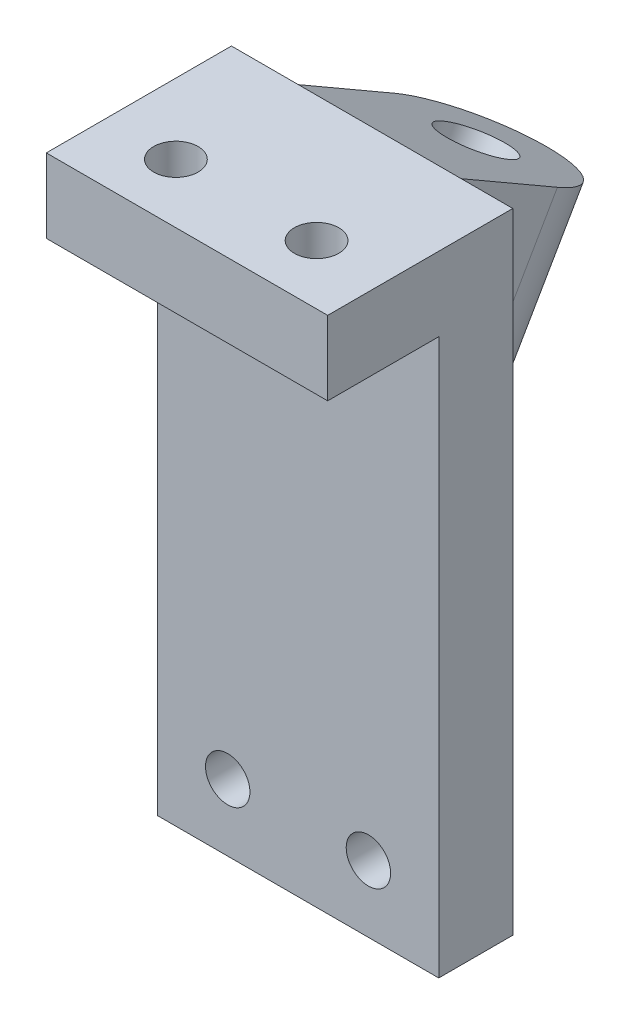
from build123d import *

# Parameters (mm, degrees)
SKETCH1_W           = 76
SKETCH1_H           = 50
SKETCH1_R           = 6
BOSS_EXTRUDE1_DEPTH = 20
SKETCH2_W           = 76
SKETCH2_H           = 20
BOSS_EXTRUDE2_DEPTH = 150
SKETCH3_R           = 6
CUT_EXTRUDE1_DEPTH  = 150
BOSS_EXTRUDE3_REACH = 186.259
SKETCH5_R           = 9


with BuildPart() as part:
    # Sketch1 → Boss-Extrude1 (new body)
    with BuildSketch(Plane(origin=(0, 0, 0), x_dir=(1, 0, 0), z_dir=(0, 1, 0))):
        Rectangle(SKETCH1_W, SKETCH1_H)
        with Locations(Location((-19, -9, 0), (0, 0, 270))):
            Circle(SKETCH1_R, mode=Mode.SUBTRACT)
        with Locations(Location((19, -9, 0), (0, 0, 90))):
            Circle(SKETCH1_R, mode=Mode.SUBTRACT)
    extrude(amount=BOSS_EXTRUDE1_DEPTH)

    # Sketch2 → Boss-Extrude2 (add)
    with BuildSketch(Plane.XZ):
        with Locations((0, -15)):
            Rectangle(SKETCH2_W, SKETCH2_H)
    extrude(amount=BOSS_EXTRUDE2_DEPTH)

    # Sketch3 → Cut-Extrude1 (cut)
    with BuildSketch(Plane(origin=(0, 0, -25), x_dir=(-1, 0, 0), z_dir=(0, 0, -1))):
        with Locations((-19, -132)):
            Circle(SKETCH3_R)
        with Locations((19, -132)):
            Circle(SKETCH3_R)
    extrude(amount=-CUT_EXTRUDE1_DEPTH, mode=Mode.SUBTRACT)

    # Sketch5 → Boss-Extrude3 (add, up to next)
    with BuildSketch(Plane(origin=(0, 25.825317547, -14.910254038), x_dir=(1, 0, 0), z_dir=(0, -0.8660254037844399, 0.4999999999999977)), mode=Mode.PRIVATE) as boss_extrude3_sk1:
        with BuildLine():
            Line((-19.931985631, -11.650635095), (24.068014369, -11.650635095))
            Line((24.068014369, -11.650635095), (24.068014369, -41.650635095))
            ThreePointArc((24.068014369, -41.650635095), (2.068014369, -63.650635095), (-19.931985631, -41.650635095))
            Line((-19.931985631, -41.650635095), (-19.931985631, -11.650635095))
        make_face()
        with Locations(Location((2.068014369, -41.650635095, 0), (0, 0, 90))):
            Circle(SKETCH5_R, mode=Mode.SUBTRACT)
    boss_extrude3_tool1 = extrude(boss_extrude3_sk1.sketch, amount=BOSS_EXTRUDE3_REACH, mode=Mode.PRIVATE) - part.part
    add(boss_extrude3_tool1.solids().sort_by_distance((-19.25081, 12.5, -37.990381))[0])


solid = part.part
